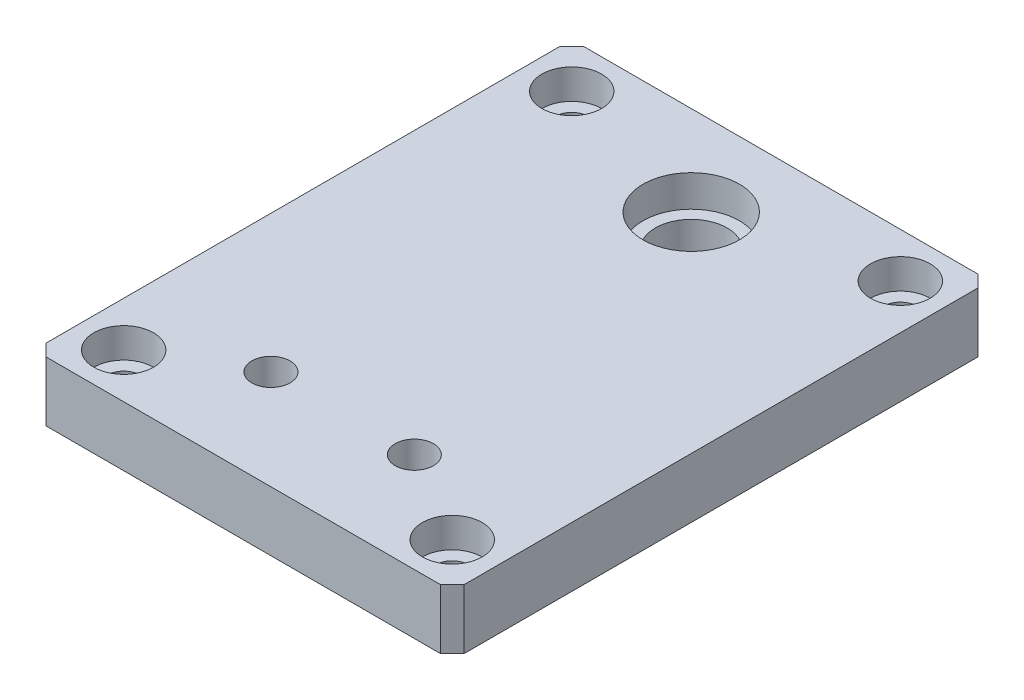
from build123d import *

# Parameters (mm, degrees)
SKETCH1_W                      = 70
SKETCH1_H                      = 90
BOSS_EXTRUDE1_DEPTH            = 10
CBORE_FOR_M5_SHCS1_D           = 5.5
CBORE_FOR_M5_SHCS1_CBORE_D     = 10
CBORE_FOR_M5_SHCS1_CBORE_DEPTH = 5
F_1_0MM_DOWEL_HOLE1_D          = 16.15
F_1_0MM_DOWEL_HOLE1_DEPTH      = 5.3
F_1_0MM_DOWEL_HOLE3_D          = 12
SKETCH14_R                     = 3.2
CUT_EXTRUDE1_DEPTH             = 58.879184514
CHAMFER1_SIZE                  = 2


with BuildPart() as part:
    # Sketch1 → Boss-Extrude1 (new body)
    with BuildSketch(Plane(origin=(0, 0, 0), x_dir=(1, 0, 0), z_dir=(0, 1, 0))):
        Rectangle(SKETCH1_W, SKETCH1_H)
    extrude(amount=BOSS_EXTRUDE1_DEPTH)

    # CBORE for M5 SHCS1 (through all)
    with Locations(Plane(origin=(0, 10, 0), x_dir=(1, 0, 0), z_dir=(0, 1, 0))):
        with Locations((-27.5, -37.5), (-27.5, 37.5), (27.5, 37.5), (27.5, -37.5)):
            CounterBoreHole(CBORE_FOR_M5_SHCS1_D / 2, CBORE_FOR_M5_SHCS1_CBORE_D / 2, CBORE_FOR_M5_SHCS1_CBORE_DEPTH)

    # Ø1.0mm Dowel Hole1
    with Locations(Plane(origin=(0, 10, 0), x_dir=(1, 0, 0), z_dir=(0, 1, 0))):
        with Locations((0, 30)):
            Hole(F_1_0MM_DOWEL_HOLE1_D / 2, depth=F_1_0MM_DOWEL_HOLE1_DEPTH)

    # Ø1.0mm Dowel Hole3 (through all)
    with Locations(Plane(origin=(0, 4.7, 0), x_dir=(1, 0, 0), z_dir=(0, 1, 0))):
        with Locations((0, 30)):
            Hole(F_1_0MM_DOWEL_HOLE3_D / 2)

    # Sketch14 → Cut-Extrude1 (cut, through all)
    with BuildSketch(Plane(origin=(0, 10, 0), x_dir=(1, 0, 0), z_dir=(0, 1, 0))):
        with Locations(Location((12, -28.35, 0), (0, 0, 270))):
            Circle(SKETCH14_R)
        with Locations(Location((-12, -28.35, 0), (0, 0, 270))):
            Circle(SKETCH14_R)
    extrude(amount=-CUT_EXTRUDE1_DEPTH, mode=Mode.SUBTRACT)

    # Chamfer1
    chamfer1_edges = [part.edges().sort_by_distance(p)[0] for p in [
        (35, 5, 45),
        (-35, 5, 45),
        (-35, 5, -45),
        (35, 5, -45),
    ]]
    chamfer(chamfer1_edges, length=CHAMFER1_SIZE)


solid = part.part
